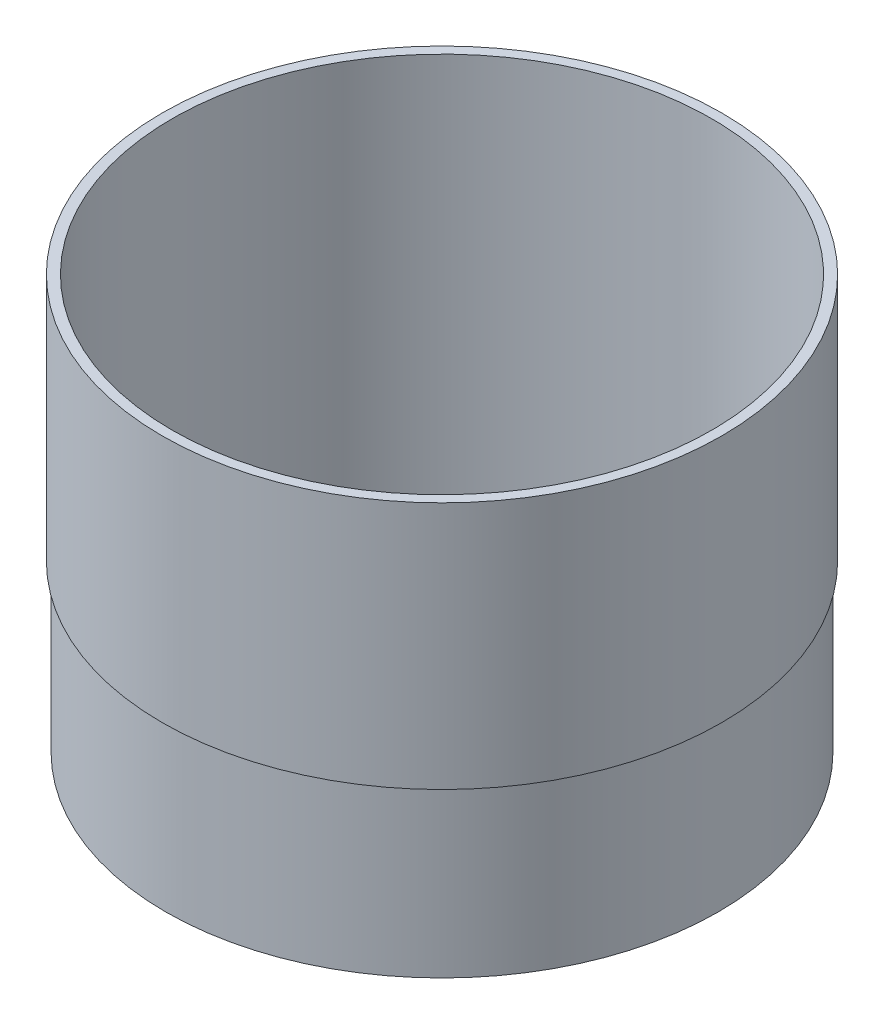
from build123d import *

# Parameters (mm, degrees)
SKETCH1_R           = 16.7
SKETCH1_R_2         = 16.3
BOSS_EXTRUDE1_DEPTH = 10
SKETCH2_R           = 16.9
SKETCH2_R_2         = 16.3
BOSS_EXTRUDE2_DEPTH = 15


with BuildPart() as part:
    # Sketch1 → Boss-Extrude1 (new body)
    with BuildSketch(Plane(origin=(0, 0, 0), x_dir=(1, 0, 0), z_dir=(0, 1, 0))):
        with Locations(Location((0, 0, 0), (0, 0, 270))):
            Circle(SKETCH1_R)
        with Locations(Location((0, 0, 0), (0, 0, 270))):
            Circle(SKETCH1_R_2, mode=Mode.SUBTRACT)
    extrude(amount=BOSS_EXTRUDE1_DEPTH)

    # Sketch2 → Boss-Extrude2 (add)
    with BuildSketch(Plane(origin=(0, 10, 0), x_dir=(1, 0, 0), z_dir=(0, 1, 0))):
        with Locations(Location((0, 0, 0), (0, 0, 270))):
            Circle(SKETCH2_R)
        with Locations(Location((0, 0, 0), (0, 0, 270))):
            Circle(SKETCH2_R_2, mode=Mode.SUBTRACT)
    extrude(amount=BOSS_EXTRUDE2_DEPTH)


solid = part.part
